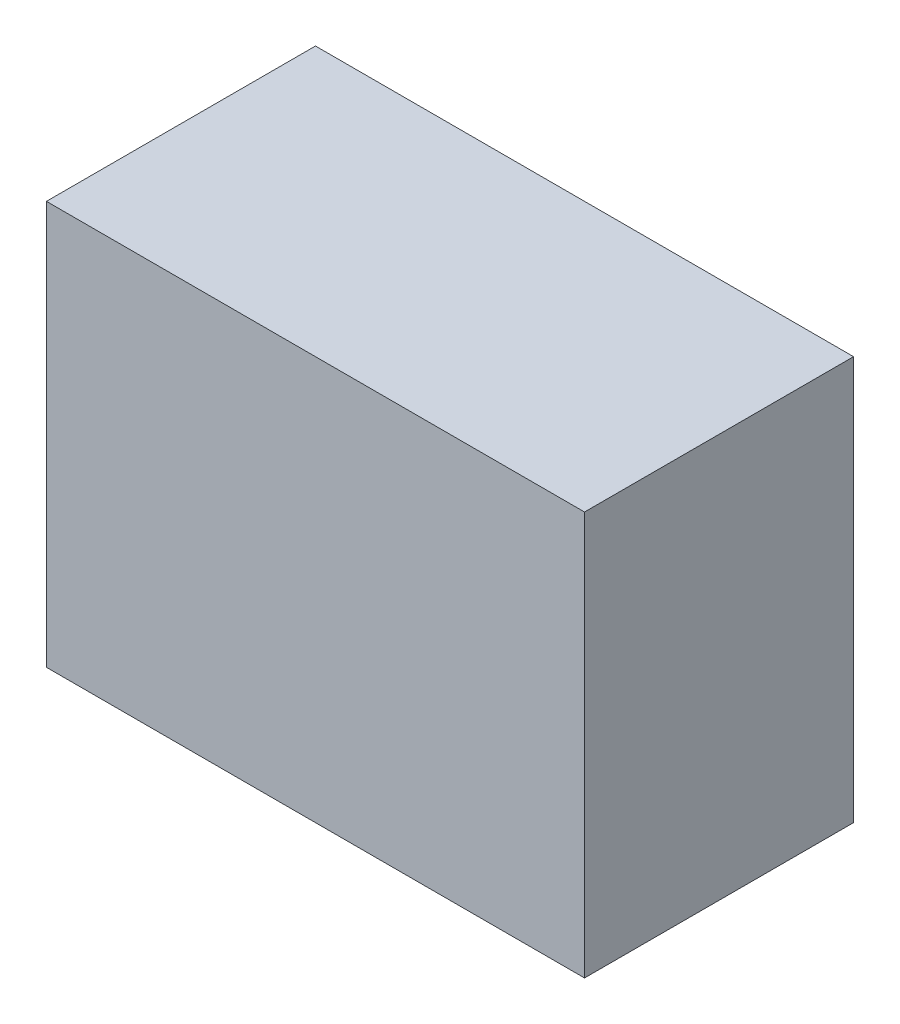
from build123d import *

# Parameters (mm, degrees)
SKETCH1_W           = 20
SKETCH1_H           = 15
BOSS_EXTRUDE1_DEPTH = 10
SKETCH2_W           = 13
SKETCH2_H           = 9
BOSS_EXTRUDE2_DEPTH = 5


with BuildPart() as part:
    # Sketch1 → Boss-Extrude1 (new body)
    with BuildSketch(Plane.XY):
        Rectangle(SKETCH1_W, SKETCH1_H)
    extrude(amount=-BOSS_EXTRUDE1_DEPTH)

    # Sketch2 → Boss-Extrude2 (add)
    with BuildSketch(Plane.XY):
        Rectangle(SKETCH2_W, SKETCH2_H)
    extrude(amount=-BOSS_EXTRUDE2_DEPTH)


solid = part.part
